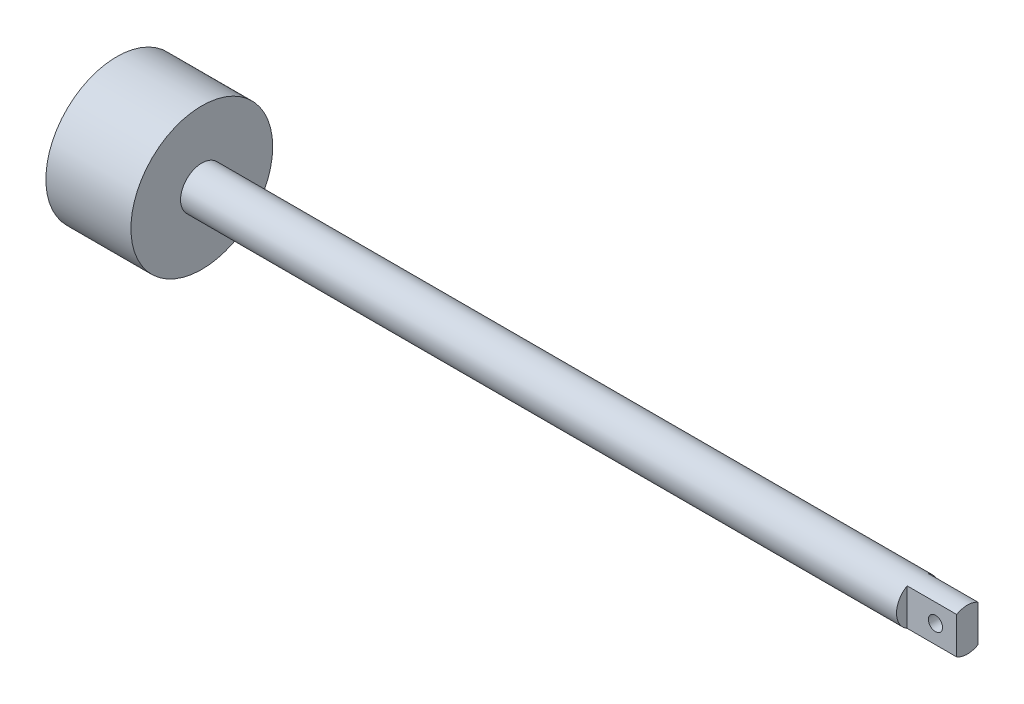
from build123d import *

# Parameters (mm, degrees)
SKETCH1_R                      = 50
BOSS_EXTRUDE2_DEPTH            = 60
SKETCH1_3_R                    = 15
BOSS_EXTRUDE3_DEPTH            = 600
CUT_EXTRUDE1_REACH             = 606.152
SKETCH2_W                      = 35
SKETCH2_H                      = 7.5
CUT_EXTRUDE1_DIRECTION_2_REACH = 606.152
CUT_EXTRUDE2_REACH             = 606.152
SKETCH3_R                      = 5
CUT_EXTRUDE2_DIRECTION_2_REACH = 606.152


with BuildPart() as part:
    # Sketch1 → Boss-Extrude2 (new body)
    with BuildSketch(Plane(origin=(0, 0, 0), x_dir=(0, 0, -1), z_dir=(1, 0, 0))):
        Circle(SKETCH1_R)
    extrude(amount=BOSS_EXTRUDE2_DEPTH)

    # Sketch1<3> → Boss-Extrude3 (add)
    with BuildSketch(Plane(origin=(0, 0, 0), x_dir=(0, 0, -1), z_dir=(1, 0, 0))):
        Circle(SKETCH1_3_R)
    extrude(amount=BOSS_EXTRUDE3_DEPTH)

    # Sketch2 → Cut-Extrude1 (cut, up to next)
    with BuildSketch(Plane(origin=(0, 0, 0), x_dir=(1, 0, 0), z_dir=(0, 1, 0)), mode=Mode.PRIVATE) as cut_extrude1_sk1:
        with Locations((582.5, 11.25)):
            Rectangle(SKETCH2_W, SKETCH2_H)
    cut_extrude1_tool1 = extrude(cut_extrude1_sk1.sketch, amount=-CUT_EXTRUDE1_REACH, mode=Mode.PRIVATE) & part.part
    # Sketch2 → Cut-Extrude1 (cut, up to next)
    with BuildSketch(Plane(origin=(0, 0, 0), x_dir=(1, 0, 0), z_dir=(0, 1, 0)), mode=Mode.PRIVATE) as cut_extrude1_sk2:
        with Locations((582.5, -11.25)):
            Rectangle(SKETCH2_W, SKETCH2_H)
    cut_extrude1_tool2 = extrude(cut_extrude1_sk2.sketch, amount=-CUT_EXTRUDE1_REACH, mode=Mode.PRIVATE) & part.part
    add(cut_extrude1_tool1.solids().sort_by_distance((582.5, 0, -11.25))[0], mode=Mode.SUBTRACT)
    add(cut_extrude1_tool2.solids().sort_by_distance((582.5, 0, 11.25))[0], mode=Mode.SUBTRACT)

    # Sketch2 → Cut-Extrude1 direction 2 (cut, up to next)
    with BuildSketch(Plane(origin=(0, 0, 0), x_dir=(1, 0, 0), z_dir=(0, 1, 0)), mode=Mode.PRIVATE) as cut_extrude1_direction_2_sk1:
        with Locations((582.5, 11.25)):
            Rectangle(SKETCH2_W, SKETCH2_H)
    cut_extrude1_direction_2_tool1 = extrude(cut_extrude1_direction_2_sk1.sketch, amount=CUT_EXTRUDE1_DIRECTION_2_REACH, mode=Mode.PRIVATE) & part.part
    # Sketch2 → Cut-Extrude1 direction 2 (cut, up to next)
    with BuildSketch(Plane(origin=(0, 0, 0), x_dir=(1, 0, 0), z_dir=(0, 1, 0)), mode=Mode.PRIVATE) as cut_extrude1_direction_2_sk2:
        with Locations((582.5, -11.25)):
            Rectangle(SKETCH2_W, SKETCH2_H)
    cut_extrude1_direction_2_tool2 = extrude(cut_extrude1_direction_2_sk2.sketch, amount=CUT_EXTRUDE1_DIRECTION_2_REACH, mode=Mode.PRIVATE) & part.part
    add(cut_extrude1_direction_2_tool1.solids().sort_by_distance((582.5, 0, -11.25))[0], mode=Mode.SUBTRACT)
    add(cut_extrude1_direction_2_tool2.solids().sort_by_distance((582.5, 0, 11.25))[0], mode=Mode.SUBTRACT)

    # Sketch3 → Cut-Extrude2 (cut, up to next)
    with BuildSketch(Plane.XY, mode=Mode.PRIVATE) as cut_extrude2_sk1:
        with Locations((585, 0)):
            Circle(SKETCH3_R)
    cut_extrude2_tool1 = extrude(cut_extrude2_sk1.sketch, amount=-CUT_EXTRUDE2_REACH, mode=Mode.PRIVATE) & part.part
    add(cut_extrude2_tool1.solids().sort_by_distance((585, 0, 0))[0], mode=Mode.SUBTRACT)

    # Sketch3 → Cut-Extrude2 direction 2 (cut, up to next)
    with BuildSketch(Plane.XY, mode=Mode.PRIVATE) as cut_extrude2_direction_2_sk1:
        with Locations((585, 0)):
            Circle(SKETCH3_R)
    cut_extrude2_direction_2_tool1 = extrude(cut_extrude2_direction_2_sk1.sketch, amount=CUT_EXTRUDE2_DIRECTION_2_REACH, mode=Mode.PRIVATE) & part.part
    add(cut_extrude2_direction_2_tool1.solids().sort_by_distance((585, 0, 0))[0], mode=Mode.SUBTRACT)


solid = part.part
